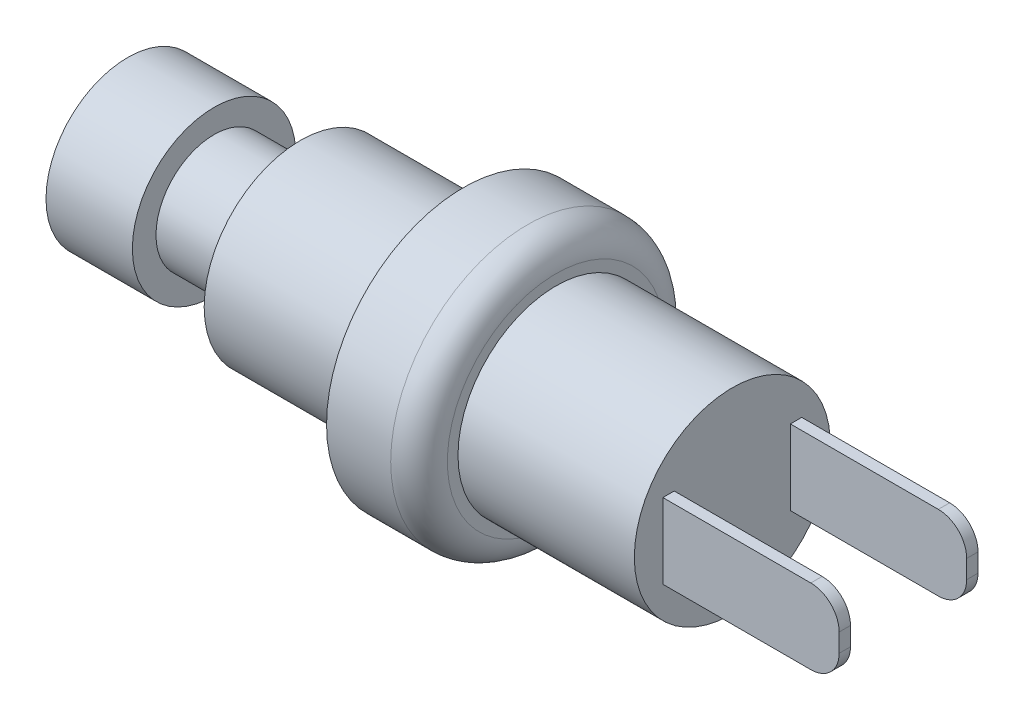
from build123d import *

# Parameters (mm, degrees)
FILLET1_R           = 1
SKETCH2_W           = 0.4
SKETCH2_H           = 2.65
BOSS_EXTRUDE1_DEPTH = 6.22
FILLET2_R           = 1


with BuildPart() as part:
    # Sketch1 → Revolve1 (revolve)
    with BuildSketch(Plane.XY, mode=Mode.PRIVATE) as revolve1_sk:
        Polygon((25.103538705, 0), (3.767538705, 0), (3.767538705, 2.883), (6.815538705, 2.883), (6.815538705, 2.049985706), (9.863538705, 2.049985706), (9.863538705, 3.397), (15.616538705, 3.397), (15.616538705, 4.832), (18.880538705, 4.832), (18.880538705, 3.457874146), (25.103538705, 3.457874146), align=None)
    revolve(revolve1_sk.sketch.rotate(Axis((0, 0, 0), (1, 0, 0)), 90), axis=Axis((0, 0, 0), (1, 0, 0)))

    # Fillet1
    fillet1_edges = [part.edges().sort_by_distance(p)[0] for p in [
        (18.880538705, 0, -4.832),
    ]]
    fillet(fillet1_edges, radius=FILLET1_R)

    # Sketch2 → Boss-Extrude1 (add)
    with BuildSketch(Plane(origin=(25.103538705, 0, 0), x_dir=(0, 0, -1), z_dir=(1, 0, 0))):
        with Locations((-2.25, 0)):
            Rectangle(SKETCH2_W, SKETCH2_H)
        with Locations((2.25, 0)):
            Rectangle(SKETCH2_W, SKETCH2_H)
    extrude(amount=BOSS_EXTRUDE1_DEPTH)

    # Fillet2
    fillet2_edges = [part.edges().sort_by_distance(p)[0] for p in [
        (31.323538705, 1.325, 2.25),
        (31.323538705, -1.325, 2.25),
        (31.323538705, 1.325, -2.25),
        (31.323538705, -1.325, -2.25),
    ]]
    fillet(fillet2_edges, radius=FILLET2_R)


solid = part.part
